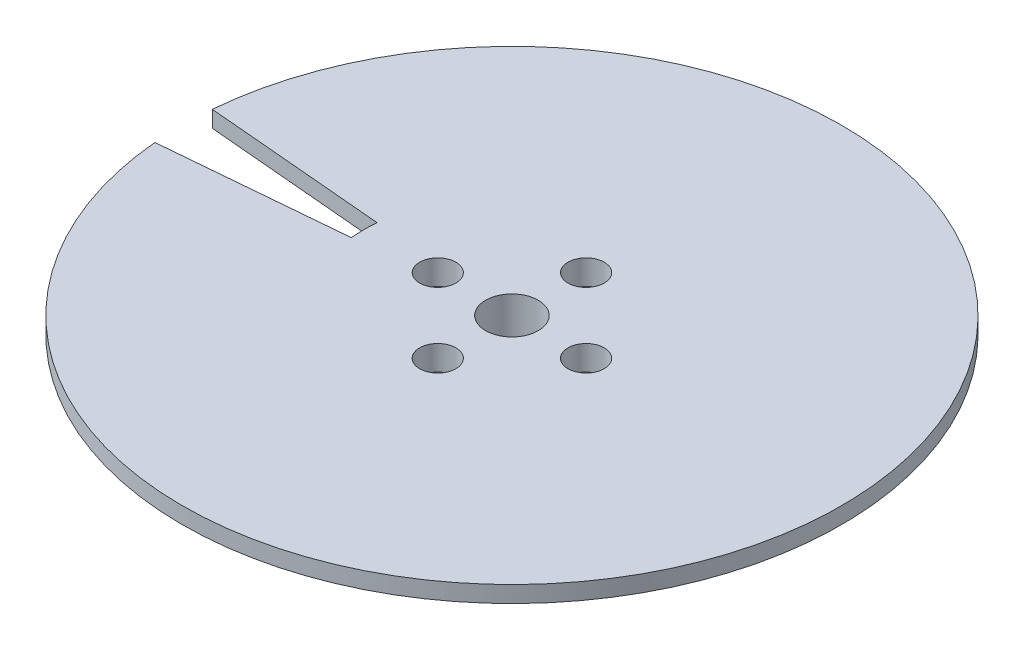
from build123d import *

# Parameters (mm, degrees)
SKETCH_1_R          = 9
SKETCH_1_R_2        = 7.5
EXTRUDE_1_DEPTH     = 6
EXTRUDE_START       = -1
EXTRUDE_2_DEPTH     = 1
EXTRUDE_3_DEPTH     = 3
EXTRUDE_START_2     = -3
SKETCH_5_R          = 7.5
EXTRUDE_4_DEPTH     = 3
SKETCH_6_R          = 1.6
CUT_EXTRUDE_1_DEPTH = 3
CHAMFER_1_SIZE      = 1
SKETCH_14_R         = 1.1
CUT_EXTRUDE_4_DEPTH = 1.5


with BuildPart() as part:
    # 草图1 → 凸台-拉伸1 (new body)
    with BuildSketch(Plane(origin=(0, 0, 0), x_dir=(1, 0, 0), z_dir=(0, 1, 0))):
        with Locations(Location((0, 0, 0), (0, 0, 270))):
            Circle(SKETCH_1_R)
        with Locations(Location((0, 0, 0), (0, 0, 270))):
            Circle(SKETCH_1_R_2, mode=Mode.SUBTRACT)
    extrude(amount=EXTRUDE_1_DEPTH)

    # 草图2 → 凸台-拉伸2 (add)
    with BuildSketch(Plane(origin=(0, 6, 0), x_dir=(1, 0, 0), z_dir=(0, 1, 0)).offset(EXTRUDE_START)):
        with BuildLine():
            Line((-19.923893962, 1.743114855), (-8.965752283, 0.784401685))
            ThreePointArc((-8.965752283, 0.784401685), (0.392574486, 8.991433994), (9, 0))
            ThreePointArc((9, 0), (0.392574486, -8.991433994), (-8.965752283, -0.784401685))
            Line((-8.965752283, -0.784401685), (-19.923893962, -1.743114855))
            ThreePointArc((-19.923893962, -1.743114855), (0.872387747, -19.980964432), (20, 0))
            ThreePointArc((20, 0), (0.872387747, 19.980964432), (-19.923893962, 1.743114855))
        make_face()
    extrude(amount=EXTRUDE_2_DEPTH)

    # 草图4 → 凸台-拉伸3 (add)
    with BuildSketch(Plane.XZ):
        with BuildLine():
            Line((0.856553191, 6.326082651), (0.856553191, 7.450927233))
            ThreePointArc((0.856553191, 7.450927233), (-0.043739259, 7.499872457), (-0.943399591, 7.440429908))
            Line((-0.943399591, 7.440429908), (-0.943399591, 6.312339741))
            Line((-0.943399591, 6.312339741), (-0.943399591, 5.418486616))
            ThreePointArc((-0.943399591, 5.418486616), (-0.044016518, 5.499823865), (0.856553191, 5.432892106))
            Line((0.856553191, 5.432892106), (0.856553191, 6.326082651))
        make_face()
        with BuildLine():
            Line((6.312339741, 0.943399591), (5.418486616, 0.943399591))
            ThreePointArc((5.418486616, 0.943399591), (5.499823865, 0.044016518), (5.432892106, -0.856553191))
            Line((5.432892106, -0.856553191), (6.326082651, -0.856553191))
            Line((6.326082651, -0.856553191), (7.450927233, -0.856553191))
            ThreePointArc((7.450927233, -0.856553191), (7.499872457, 0.043739259), (7.440429908, 0.943399591))
            Line((7.440429908, 0.943399591), (6.312339741, 0.943399591))
        make_face()
        with BuildLine():
            Line((0.943399591, -6.312339741), (0.943399591, -5.418486616))
            ThreePointArc((0.943399591, -5.418486616), (0.044016518, -5.499823865), (-0.856553191, -5.432892106))
            Line((-0.856553191, -5.432892106), (-0.856553191, -6.326082651))
            Line((-0.856553191, -6.326082651), (-0.856553191, -7.450927233))
            ThreePointArc((-0.856553191, -7.450927233), (0.043739259, -7.499872457), (0.943399591, -7.440429908))
            Line((0.943399591, -7.440429908), (0.943399591, -6.312339741))
        make_face()
        with BuildLine():
            Line((-6.312339741, -0.943399591), (-5.418486616, -0.943399591))
            ThreePointArc((-5.418486616, -0.943399591), (-5.499823865, -0.044016518), (-5.432892106, 0.856553191))
            Line((-5.432892106, 0.856553191), (-6.326082651, 0.856553191))
            Line((-6.326082651, 0.856553191), (-7.450927233, 0.856553191))
            ThreePointArc((-7.450927233, 0.856553191), (-7.499872457, -0.043739259), (-7.440429908, -0.943399591))
            Line((-7.440429908, -0.943399591), (-6.312339741, -0.943399591))
        make_face()
    extrude(amount=-EXTRUDE_3_DEPTH)

    # 草图5 → 凸台-拉伸4 (add)
    with BuildSketch(Plane(origin=(0, 6, 0), x_dir=(1, 0, 0), z_dir=(0, 1, 0)).offset(EXTRUDE_START_2)):
        Circle(SKETCH_5_R)
    extrude(amount=EXTRUDE_4_DEPTH)

    # 草图6 → 切除-拉伸1 (cut)
    with BuildSketch(Plane(origin=(0, 6, 0), x_dir=(1, 0, 0), z_dir=(0, 1, 0))):
        with Locations(Location((0, 0, 0), (0, 0, 270))):
            Circle(SKETCH_6_R)
    extrude(amount=-CUT_EXTRUDE_1_DEPTH, mode=Mode.SUBTRACT)

    # 倒角1
    chamfer_1_edges = [part.edges().sort_by_distance(p)[0] for p in [
        (0, 0, -9),
    ]]
    chamfer(chamfer_1_edges, length=CHAMFER_1_SIZE)

    # 草图14 → 切除-拉伸4 (cut)
    with BuildSketch(Plane(origin=(0, 6, 0), x_dir=(1, 0, 0), z_dir=(0, 1, 0))):
        with Locations(Location((0, 4.5, 0), (0, 0, 270))):
            Circle(SKETCH_14_R)
        with Locations(Location((4.5, 0, 0), (0, 0, 270))):
            Circle(SKETCH_14_R)
        with Locations(Location((0, -4.5, 0), (0, 0, 270))):
            Circle(SKETCH_14_R)
        with Locations(Location((-4.5, 0, 0), (0, 0, 270))):
            Circle(SKETCH_14_R)
    extrude(amount=-CUT_EXTRUDE_4_DEPTH, mode=Mode.SUBTRACT)


solid = part.part
